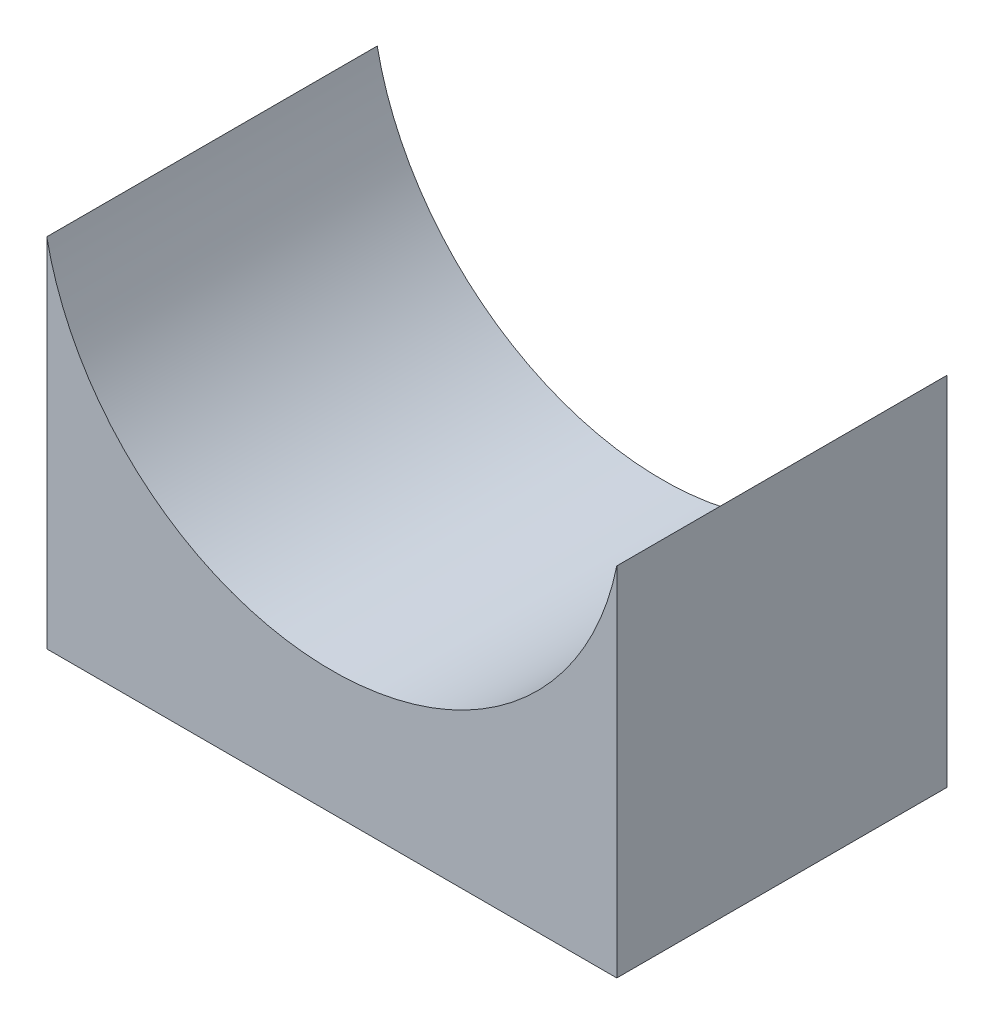
from build123d import *

# Parameters (mm, degrees)
BOSS_EXTRUDE1_DEPTH = 25.4


with BuildPart() as part:
    # Sketch1 → Boss-Extrude1 (new body)
    with BuildSketch(Plane.XY):
        with BuildLine():
            Line((-21.9075, -31.867464773), (21.9075, -31.867464773))
            Line((21.9075, -31.867464773), (21.9075, -4.435464773))
            ThreePointArc((21.9075, -4.435464773), (0, -22.352), (-21.9075, -4.435464773))
            Line((-21.9075, -4.435464773), (-21.9075, -31.867464773))
        make_face()
    extrude(amount=BOSS_EXTRUDE1_DEPTH)


solid = part.part
